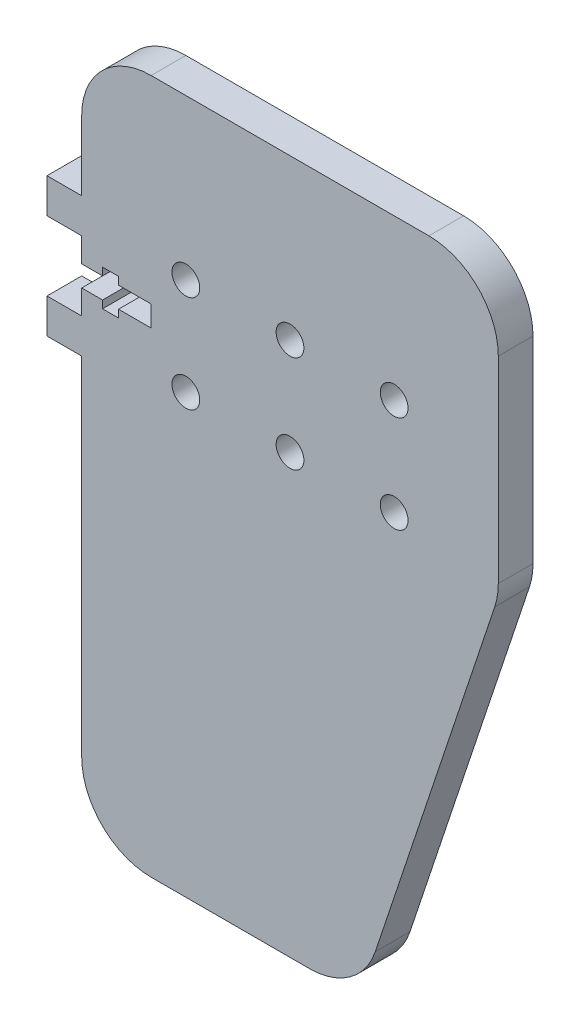
from build123d import *

# Parameters (mm, degrees)
ESQUISSE1_R        = 2
BOSS_EXTRU_1_DEPTH = 5
CONG_1_R           = 10


with BuildPart() as part:
    # Esquisse1 → Boss.-Extru.1 (new body)
    with BuildSketch(Plane.XY):
        Polygon((0, 80), (0, 100), (60, 100), (60, 60), (40, 0), (0, 0), (0, 60), (-5, 60), (-5, 65), (0, 65), (0, 68.5), (3, 68.5), (3, 67.4), (5.3, 67.4), (5.3, 68.5), (10, 68.5), (10, 71.5), (5.3, 71.5), (5.3, 72.6), (3, 72.6), (3, 71.5), (0, 71.5), (0, 75), (-5, 75), (-5, 80), align=None)
        with Locations((15, 77)):
            Circle(ESQUISSE1_R, mode=Mode.SUBTRACT)
        with Locations((30, 77)):
            Circle(ESQUISSE1_R, mode=Mode.SUBTRACT)
        with Locations((45, 77)):
            Circle(ESQUISSE1_R, mode=Mode.SUBTRACT)
        with Locations((45, 63)):
            Circle(ESQUISSE1_R, mode=Mode.SUBTRACT)
        with Locations((30, 63)):
            Circle(ESQUISSE1_R, mode=Mode.SUBTRACT)
        with Locations((15, 63)):
            Circle(ESQUISSE1_R, mode=Mode.SUBTRACT)
    extrude(amount=BOSS_EXTRU_1_DEPTH)

    # Congé1
    cong_1_edges = [part.edges().sort_by_distance(p)[0] for p in [
        (0, 100, 2.5),
        (60, 100, 2.5),
        (60, 60, 2.5),
        (40, 0, 2.5),
        (0, 0, 2.5),
    ]]
    fillet(cong_1_edges, radius=CONG_1_R)


solid = part.part
